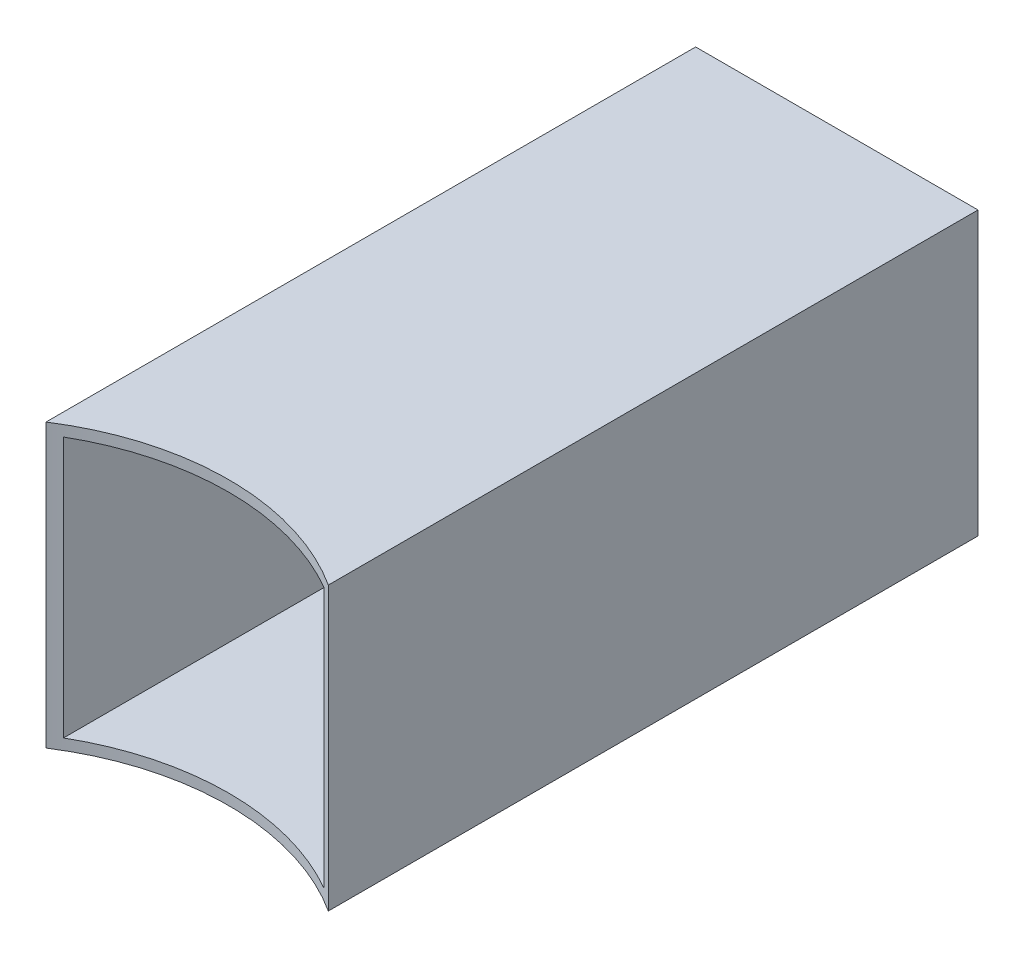
from build123d import *

# Parameters (mm, degrees)
CROQUIS1_W              = 13
CROQUIS1_H              = 13
SALIENTE_EXTRUIR1_DEPTH = 40
CORTAR_EXTRUIR1_REACH   = 43.043
CROQUIS2_W              = 12
CROQUIS2_H              = 12
CROQUIS4_R              = 12
CORTAR_EXTRUIR3_DEPTH   = 26


with BuildPart() as part:
    # Croquis1 → Saliente-Extruir1 (new body)
    with BuildSketch(Plane.XY):
        Rectangle(CROQUIS1_W, CROQUIS1_H)
    extrude(amount=SALIENTE_EXTRUIR1_DEPTH)

    # Croquis2 → Cortar-Extruir1 (cut, up to next)
    with BuildSketch(Plane.XY.offset(40), mode=Mode.PRIVATE) as cortar_extruir1_sk1:
        Rectangle(CROQUIS2_W, CROQUIS2_H)
    cortar_extruir1_tool1 = extrude(cortar_extruir1_sk1.sketch, amount=-CORTAR_EXTRUIR1_REACH, mode=Mode.PRIVATE) & part.part
    add(cortar_extruir1_tool1.solids().sort_by_distance((0, 0, 40))[0], mode=Mode.SUBTRACT)

    # Croquis4 → Cortar-Extruir3 (cut)
    with BuildSketch(Plane(origin=(0, 6.5, 0), x_dir=(1, 0, 0), z_dir=(0, 1, 0))):
        with Locations((0, -40)):
            Circle(CROQUIS4_R)
    extrude(amount=-CORTAR_EXTRUIR3_DEPTH, mode=Mode.SUBTRACT)


solid = part.part
